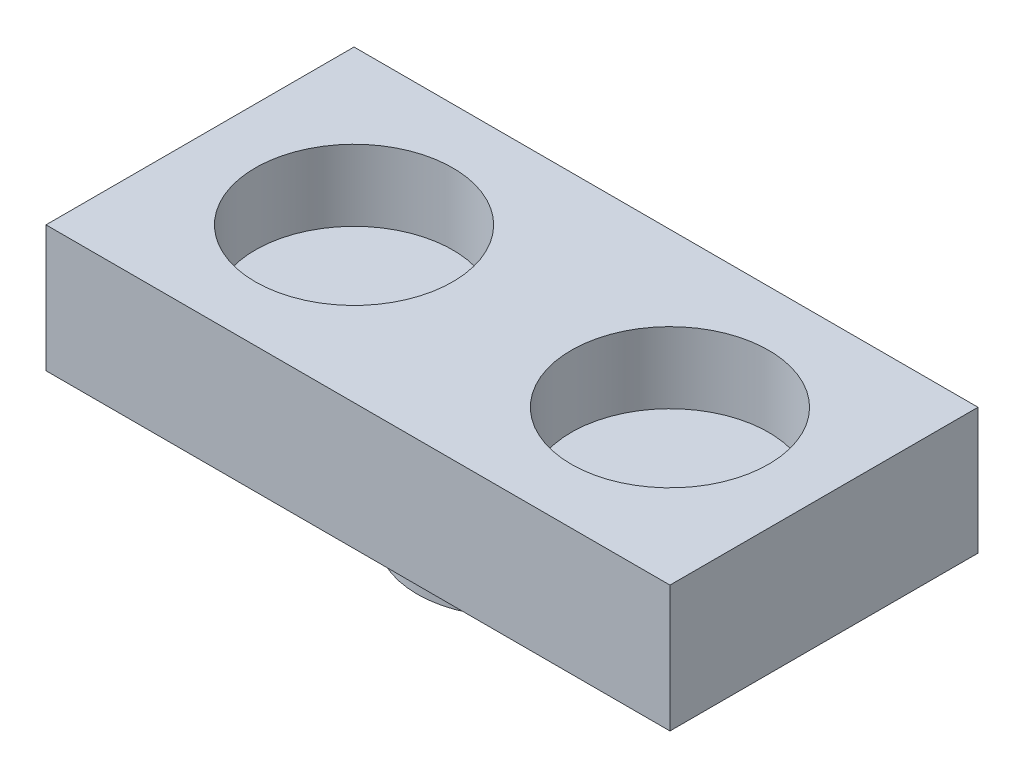
from build123d import *

# Parameters (mm, degrees)
SKETCH_1_W          = 15.8
SKETCH_1_H          = 7.8
SKETCH_1_R          = 2.4
EXTRUDE_1_DEPTH     = 3.2
SKETCH_2_R          = 2.4
SKETCH_2_R_2        = 1.6
EXTRUDE_2_DEPTH     = 1.7
SKETCH_3_R          = 2.5
CUT_EXTRUDE_2_DEPTH = 1.8


with BuildPart() as part:
    # Эскиз1 → Бобышка-Вытянуть1 (new body)
    # profile 1 of 2: a face of its own
    with BuildSketch(Plane(origin=(0, 0, 0), x_dir=(1, 0, 0), z_dir=(0, 1, 0))):
        Rectangle(SKETCH_1_W, SKETCH_1_H)
        Circle(SKETCH_1_R, mode=Mode.SUBTRACT)
    # profile 2 of 2: a face of its own
    with BuildSketch(Plane(origin=(0, 0, 0), x_dir=(1, 0, 0), z_dir=(0, 1, 0))):
        Circle(SKETCH_1_R)
    extrude(amount=EXTRUDE_1_DEPTH)

    # Эскиз2 → Бобышка-Вытянуть2 (add)
    with BuildSketch(Plane(origin=(0, 0, 0), x_dir=(1, 0, 0), z_dir=(0, 1, 0))):
        with Locations(Location((0, 0, 0), (0, 0, 270))):
            Circle(SKETCH_2_R)
        with Locations(Location((0, 0, 0), (0, 0, 270))):
            Circle(SKETCH_2_R_2, mode=Mode.SUBTRACT)
    extrude(amount=-EXTRUDE_2_DEPTH)

    # Эскиз3 → Вырез-Вытянуть2 (cut)
    with BuildSketch(Plane(origin=(0, 3.2, 0), x_dir=(1, 0, 0), z_dir=(0, 1, 0))):
        with Locations(Location((-4, 0, 0), (0, 0, 270))):
            Circle(SKETCH_3_R)
        with Locations(Location((4, 0, 0), (0, 0, 270))):
            Circle(SKETCH_3_R)
    extrude(amount=-CUT_EXTRUDE_2_DEPTH, mode=Mode.SUBTRACT)


solid = part.part
